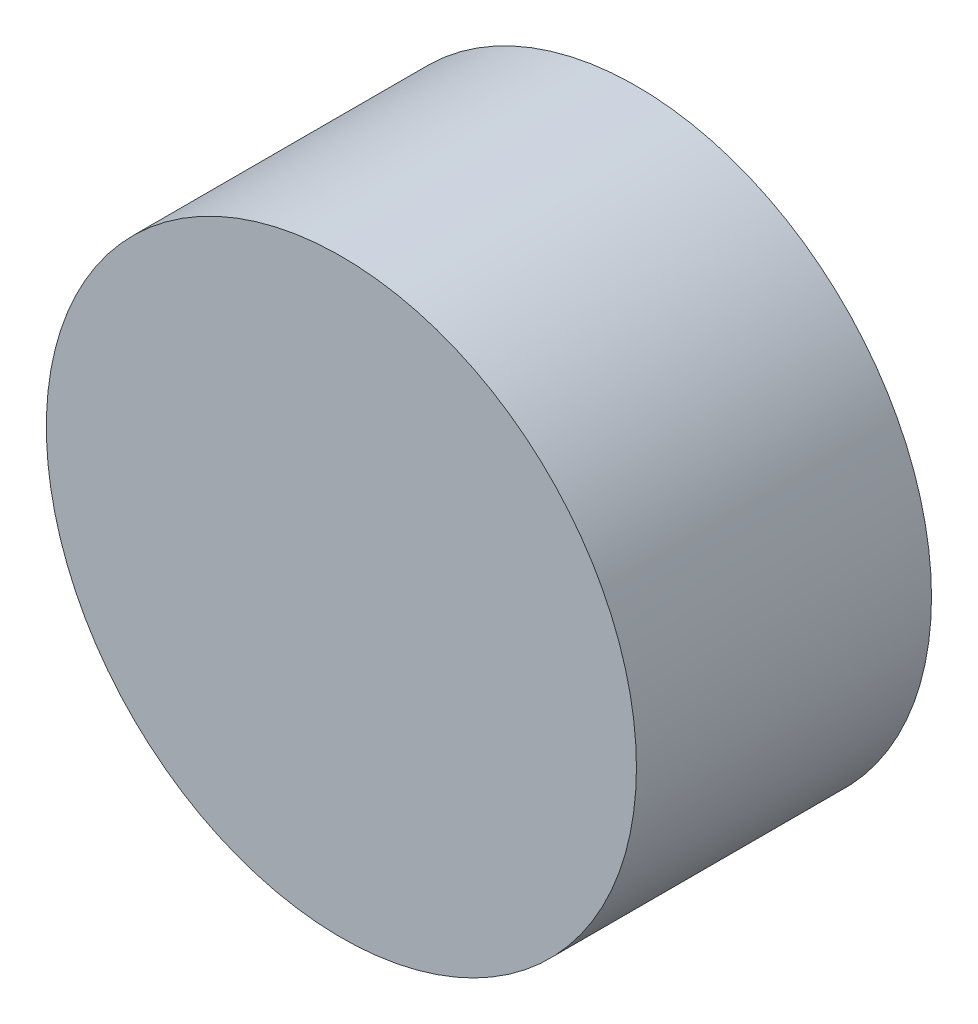
from build123d import *

# Parameters (mm, degrees)
SKETCH1_R           = 15
BOSS_EXTRUDE1_DEPTH = 15


with BuildPart() as part:
    # Sketch1 → Boss-Extrude1 (new body)
    with BuildSketch(Plane.XY):
        Circle(SKETCH1_R)
    extrude(amount=BOSS_EXTRUDE1_DEPTH)


solid = part.part
